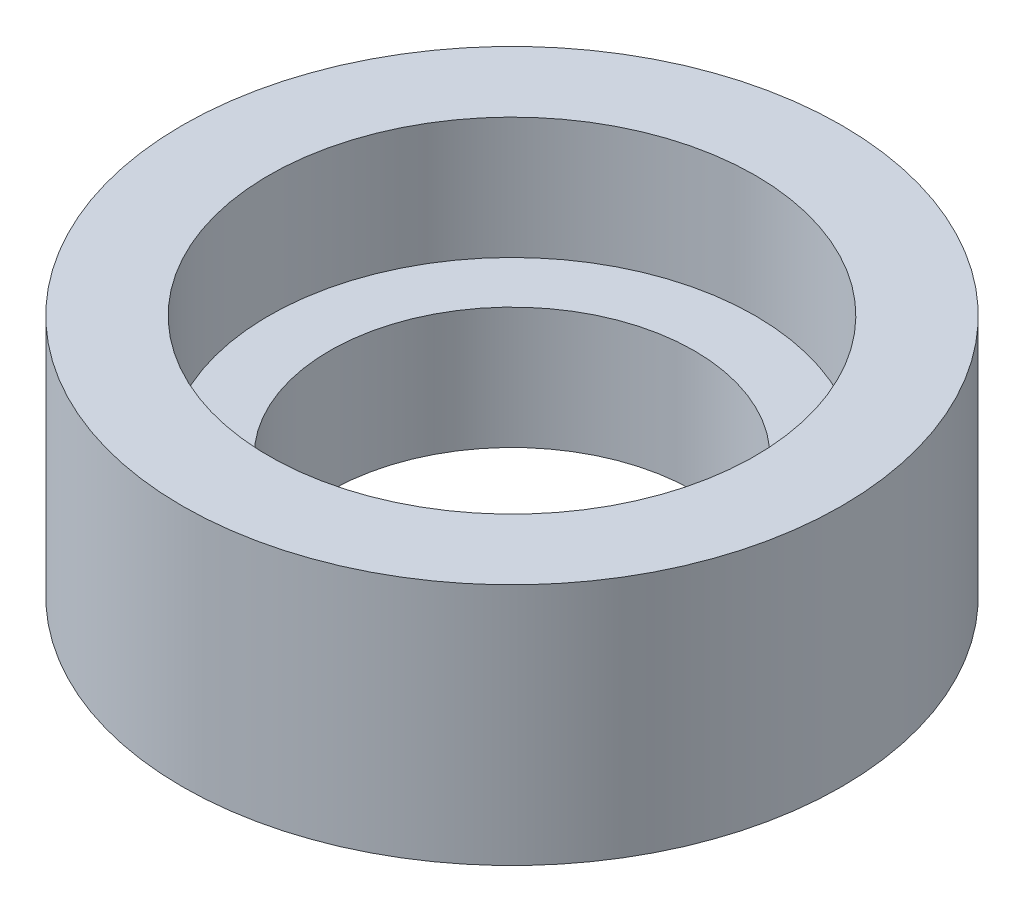
from build123d import *


with BuildPart() as part:
    # Sketch1 → Revolve1 (revolve)
    with BuildSketch(Plane.XY, mode=Mode.PRIVATE) as revolve1_sk:
        Polygon((-4.3053, 3.175), (-4.3053, 0), (-2.38125, 0), (-2.38125, 1.5875), (-3.175, 1.5875), (-3.175, 3.175), align=None)
    revolve(revolve1_sk.sketch.rotate(Axis((0, 0, 0), (0, 1, 0)), 270), axis=Axis((0, 0, 0), (0, 1, 0)))


solid = part.part
